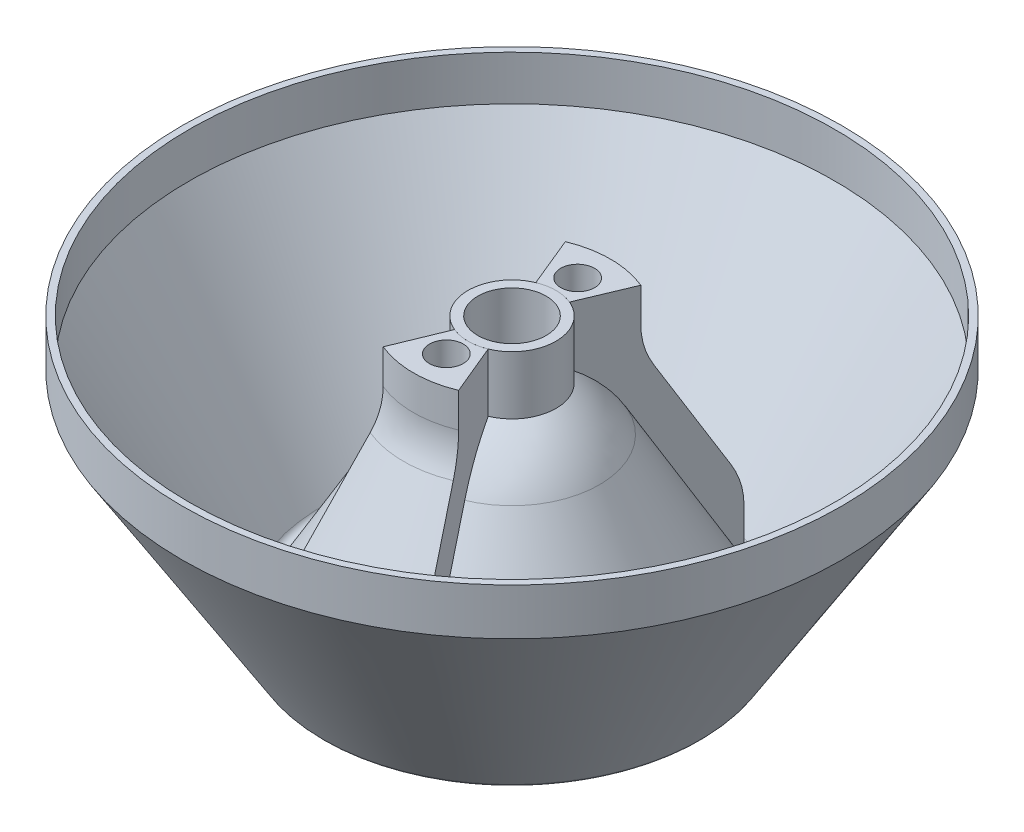
from build123d import *

# Parameters (mm, degrees)
REVOLVE9_ANGLE     = 45
CUT_REVOLVE4_ANGLE = 30
CUT_EXTRUDE1_START = -7.755429
SKETCH11_R         = 2.5
CUT_EXTRUDE1_DEPTH = 7.755429
CIRPATTERN12_COUNT = 2
CIRPATTERN12_ANGLE = 180


with BuildPart() as part:
    # Sketch1 → Revolve7 (revolve)
    with BuildSketch(Plane(origin=(0, 0, 0), x_dir=(0, 0, -1), z_dir=(1, 0, 0))):
        with BuildLine():
            Line((-48.728965868, 20.832969512), (-48.728965868, 13.935351474))
            Line((-48.728965868, 13.935351474), (-27.921225233, -19.419545618))
            ThreePointArc((-27.921225233, -19.419545618), (-27.055647383, -19.89011474), (-26.206700037, -19.390166026))
            Line((-26.206700037, -19.390166026), (-12.042822977, 5.148637149))
            ThreePointArc((-12.042822977, 5.148637149), (-9.022213685, 9.01536435), (-5.052546128, 11.89935451))
            Line((-5.052546128, 11.89935451), (-5.052546128, 20.832969512))
            Line((-5.052546128, 20.832969512), (-6.502327374, 20.832969512))
            Line((-6.502327374, 20.832969512), (-6.502327374, 12.22238818))
            ThreePointArc((-6.502327374, 12.22238818), (-10.117005004, 9.336386742), (-12.908903509, 5.648541651))
            Line((-12.908903509, 5.648541651), (-26.239989701, -17.447458038))
            ThreePointArc((-26.239989701, -17.447458038), (-27.088937047, -17.947406752), (-27.954514897, -17.47683763))
            Line((-27.954514897, -17.47683763), (-47.728965868, 14.221691717))
            Line((-47.728965868, 14.221691717), (-47.728965868, 20.832969512))
            Line((-47.728965868, 20.832969512), (-48.728965868, 20.832969512))
        make_face()
    revolve(axis=Axis((0, 0, 0), (0, -1, 0)))


with BuildPart() as body_2:
    # Sketch4 → Revolve9 (revolve, symmetric)
    with BuildSketch(Plane(origin=(0, 0, 0), x_dir=(0, 0, -1), z_dir=(1, 0, 0))) as revolve9_sk:
        with BuildLine():
            Line((-26.239989701, -17.447458038), (-26.239989701, -10.392338827))
            ThreePointArc((-26.239989701, -10.392338827), (-25.865330741, -7.545915144), (-24.766875558, -4.893389303))
            Line((-24.766875558, -4.893389303), (-16.043683511, 10.219470812))
            ThreePointArc((-16.043683511, 10.219470812), (-14.945228328, 12.871996653), (-14.570569368, 15.718420336))
            Line((-14.570569368, 15.718420336), (-14.570569368, 20.807254449))
            Line((-14.570569368, 20.807254449), (-6.502327374, 20.832969512))
            Line((-6.502327374, 20.832969512), (-6.502327374, 12.22238818))
            ThreePointArc((-6.502327374, 12.22238818), (-10.117005004, 9.336386742), (-12.908903509, 5.648541651))
            Line((-12.908903509, 5.648541651), (-26.239989701, -17.447458038))
        make_face()
    revolve(axis=Axis((0, 0, 0), (0, -1, 0)), revolution_arc=REVOLVE9_ANGLE / 2)
    revolve(revolve9_sk.sketch, axis=Axis((0, 0, 0), (0, 1, 0)), revolution_arc=REVOLVE9_ANGLE / 2)

    # Sketch6 → Cut-Revolve4 (revolve, symmetric, cut)
    with BuildSketch(Plane(origin=(0, 0, 0), x_dir=(0, 0, -1), z_dir=(1, 0, 0))) as cut_revolve4_sk:
        with BuildLine():
            Line((-23.900795026, -5.393293805), (-15.177602979, 9.71956631))
            ThreePointArc((-15.177602979, 9.71956631), (-14.394768906, 11.347895879), (-13.865275202, 13.075299362))
            Line((-13.865275202, 13.075299362), (-7.024383421, 13.075299362))
            ThreePointArc((-7.024383421, 13.075299362), (-10.833164358, 10.034323544), (-13.774984042, 6.148446154))
            Line((-13.774984042, 6.148446154), (-25.239989701, -13.714584011))
            Line((-25.239989701, -13.714584011), (-25.239989701, -10.392338827))
            ThreePointArc((-25.239989701, -10.392338827), (-24.899390647, -7.804680933), (-23.900795026, -5.393293805))
        make_face()
    revolve(axis=Axis((0, 0, 0), (0, -1, 0)), revolution_arc=CUT_REVOLVE4_ANGLE / 2, mode=Mode.SUBTRACT)
    revolve(cut_revolve4_sk.sketch, axis=Axis((0, 0, 0), (0, 1, 0)), revolution_arc=CUT_REVOLVE4_ANGLE / 2, mode=Mode.SUBTRACT)

    # Sketch11 → Cut-Extrude1 (cut)
    with BuildSketch(Plane.XZ.offset(-13.075299362).offset(CUT_EXTRUDE1_START)):
        with Locations(Location((0, 9.705615441, 0), (0, 0, 270))):
            Circle(SKETCH11_R)
    extrude(amount=CUT_EXTRUDE1_DEPTH, mode=Mode.SUBTRACT)


with BuildPart() as cirpattern12_1:
    # CirPattern12: pattern copy
    add(body_2.part.rotate(Axis((0, 0, 0), (0, 1, 0)), 1 * CIRPATTERN12_ANGLE / (CIRPATTERN12_COUNT - 1)))


solid = Compound([part.part, body_2.part, cirpattern12_1.part])
